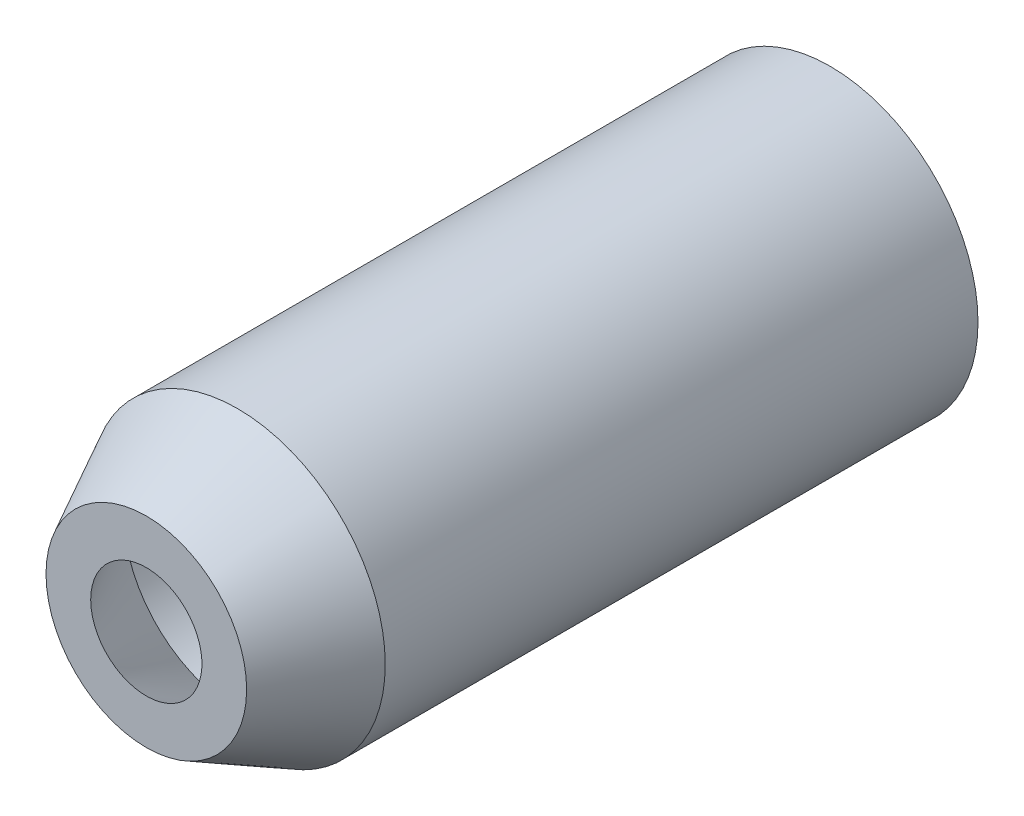
from build123d import *

# Parameters (mm, degrees)
SKETCH1_R           = 32.4
SKETCH1_R_2         = 25
BOSS_EXTRUDE1_DEPTH = 130


with BuildPart() as part:
    # Sketch1 → Boss-Extrude1 (new body)
    with BuildSketch(Plane.XY):
        Circle(SKETCH1_R)
        Circle(SKETCH1_R_2, mode=Mode.SUBTRACT)
    extrude(amount=BOSS_EXTRUDE1_DEPTH)

    # Sketch8 → Revolve1 (revolve)
    with BuildSketch(Plane(origin=(0, 0, 0), x_dir=(0, 0, -1), z_dir=(1, 0, 0)), mode=Mode.PRIVATE) as revolve1_sk:
        Polygon((-130, 32.4), (-150, 22), (-150, 12.2), (-130, 25), align=None)
    revolve(revolve1_sk.sketch.rotate(Axis((0, 0, -1366.143175617), (0, 0, 1)), 90), axis=Axis((0, 0, -1366.143175617), (0, 0, 1)))


solid = part.part
